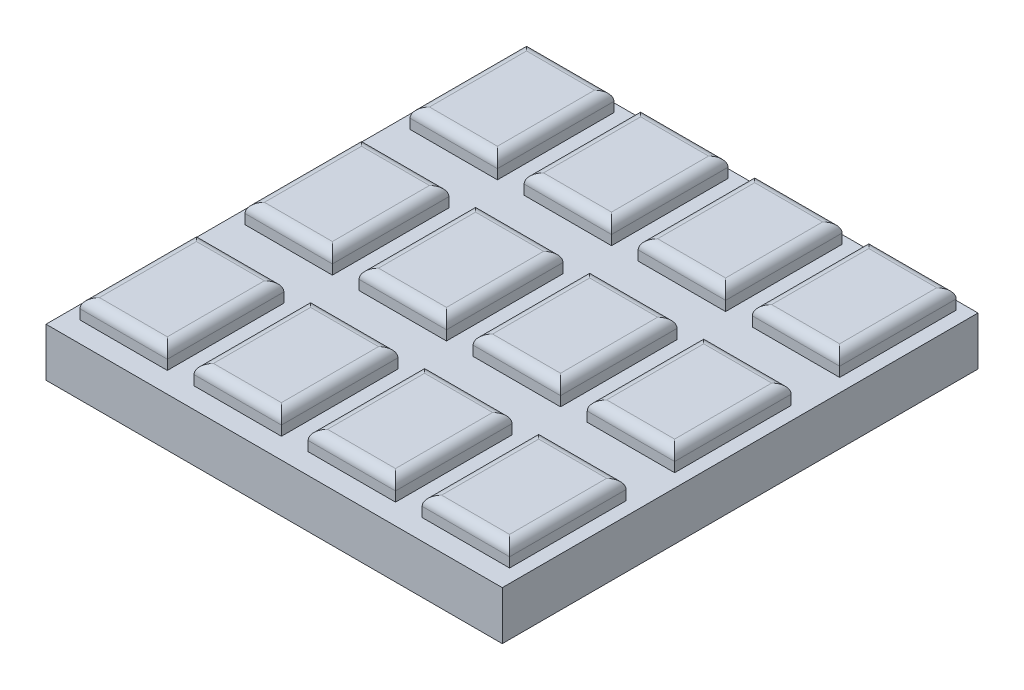
from build123d import *

# Parameters (mm, degrees)
SKETCH1_W              = 47
SKETCH1_H              = 49
BOSS_EXTRUDE1_DEPTH    = 5
SKETCH2_W              = 9
SKETCH2_H              = 12
BOSS_EXTRUDE2_DEPTH    = 2
FILLET1_R              = 1
LPATTERN1_COUNT        = 4
LPATTERN1_PITCH        = 11.75
LPATTERN1_COUNT_DIR2   = 3
LPATTERN1_PITCH_DIR2   = 17
FILLET1_OF_LPATTERN1_R = 1


with BuildPart() as part:
    # Sketch1 → Boss-Extrude1 (new body)
    with BuildSketch(Plane(origin=(0, 0, 0), x_dir=(1, 0, 0), z_dir=(0, 1, 0))):
        Rectangle(SKETCH1_W, SKETCH1_H)
    extrude(amount=BOSS_EXTRUDE1_DEPTH)

    # Sketch2 → Boss-Extrude2 (add)
    with BuildSketch(Plane(origin=(0, 5, 0), x_dir=(1, 0, 0), z_dir=(0, 1, 0))):
        with Locations((-17.625, 17.625)):
            Rectangle(SKETCH2_W, SKETCH2_H)
    boss_extrude2 = extrude(amount=BOSS_EXTRUDE2_DEPTH)

    # Fillet1
    fillet1_edges = [part.edges().sort_by_distance(p)[0] for p in [
        (-13.125, 7, -17.625),
        (-17.625, 7, -23.625),
        (-17.625, 7, -11.625),
        (-22.125, 7, -17.625),
    ]]
    fillet(fillet1_edges, radius=FILLET1_R)

    # LPattern1: Boss-Extrude2 4 × 3
    with Locations(*[(i * LPATTERN1_PITCH, 0, j * LPATTERN1_PITCH_DIR2) for i in range(LPATTERN1_COUNT) for j in range(LPATTERN1_COUNT_DIR2) if (i, j) != (0, 0)]):
        add(boss_extrude2)

    # Fillet1 of LPattern1
    fillet1_of_lpattern1_edges = [part.edges().sort_by_distance(p)[0] for p in [
        (-13.125, 7, -0.625),
        (-17.625, 7, -6.625),
        (-17.625, 7, 5.375),
        (-22.125, 7, -0.625),
        (-13.125, 7, 16.375),
        (-17.625, 7, 10.375),
        (-17.625, 7, 22.375),
        (-22.125, 7, 16.375),
        (-1.375, 7, -17.625),
        (-5.875, 7, -23.625),
        (-5.875, 7, -11.625),
        (-10.375, 7, -17.625),
        (-1.375, 7, -0.625),
        (-5.875, 7, -6.625),
        (-5.875, 7, 5.375),
        (-10.375, 7, -0.625),
        (-1.375, 7, 16.375),
        (-5.875, 7, 10.375),
        (-5.875, 7, 22.375),
        (-10.375, 7, 16.375),
        (10.375, 7, -17.625),
        (5.875, 7, -23.625),
        (5.875, 7, -11.625),
        (1.375, 7, -17.625),
        (10.375, 7, -0.625),
        (5.875, 7, -6.625),
        (5.875, 7, 5.375),
        (1.375, 7, -0.625),
        (10.375, 7, 16.375),
        (5.875, 7, 10.375),
        (5.875, 7, 22.375),
        (1.375, 7, 16.375),
        (22.125, 7, -17.625),
        (17.625, 7, -23.625),
        (17.625, 7, -11.625),
        (13.125, 7, -17.625),
        (22.125, 7, -0.625),
        (17.625, 7, -6.625),
        (17.625, 7, 5.375),
        (13.125, 7, -0.625),
        (22.125, 7, 16.375),
        (17.625, 7, 10.375),
        (17.625, 7, 22.375),
        (13.125, 7, 16.375),
    ]]
    fillet(fillet1_of_lpattern1_edges, radius=FILLET1_OF_LPATTERN1_R)


solid = part.part
